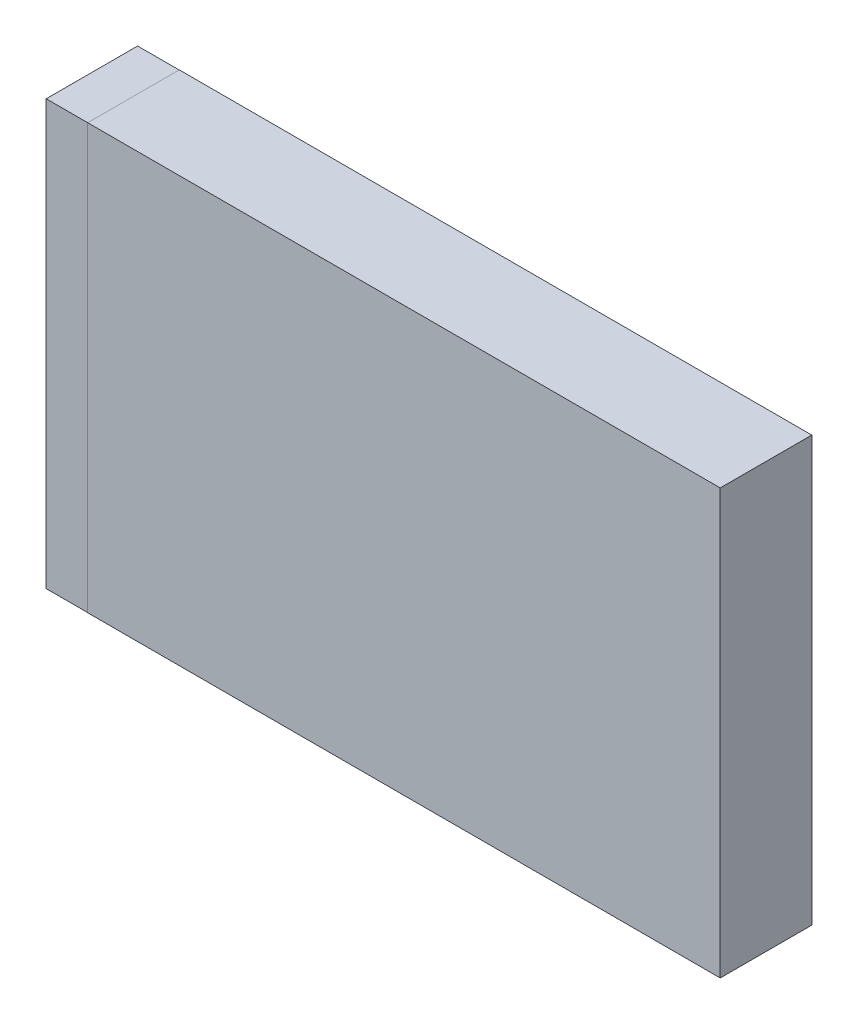
from build123d import *

# Parameters (mm, degrees)
SKETCH1_W           = 81
SKETCH1_H           = 51
BOSS_EXTRUDE1_DEPTH = 11
SKETCH2_W           = 5
SKETCH2_H           = 51
CUT_EXTRUDE1_DEPTH  = 0.01
SKETCH3_W           = 5
SKETCH3_H           = 10.99
CUT_EXTRUDE2_DEPTH  = 0.01
SKETCH4_W           = 5
SKETCH4_H           = 51
CUT_EXTRUDE3_DEPTH  = 0.01
SKETCH5_W           = 5
SKETCH5_H           = 11
CUT_EXTRUDE4_DEPTH  = 0.01


with BuildPart() as part:
    # Sketch1 → Boss-Extrude1 (new body)
    with BuildSketch(Plane.XY):
        with Locations((40.5, 25.5)):
            Rectangle(SKETCH1_W, SKETCH1_H)
    extrude(amount=BOSS_EXTRUDE1_DEPTH)

    # Sketch2 → Cut-Extrude1 (cut)
    with BuildSketch(Plane.XY.offset(11)):
        with Locations((2.5, 25.5)):
            Rectangle(SKETCH2_W, SKETCH2_H)
    extrude(amount=-CUT_EXTRUDE1_DEPTH, mode=Mode.SUBTRACT)

    # Sketch3 → Cut-Extrude2 (cut)
    with BuildSketch(Plane.XZ):
        with Locations((2.5, 5.495)):
            Rectangle(SKETCH3_W, SKETCH3_H)
    extrude(amount=-CUT_EXTRUDE2_DEPTH, mode=Mode.SUBTRACT)

    # Sketch4 → Cut-Extrude3 (cut)
    with BuildSketch(Plane(origin=(0, 0, 0), x_dir=(-1, 0, 0), z_dir=(0, 0, -1))):
        with Locations((-2.5, 25.5)):
            Rectangle(SKETCH4_W, SKETCH4_H)
    extrude(amount=-CUT_EXTRUDE3_DEPTH, mode=Mode.SUBTRACT)

    # Sketch5 → Cut-Extrude4 (cut)
    with BuildSketch(Plane(origin=(0, 51, 0), x_dir=(1, 0, 0), z_dir=(0, 1, 0))):
        with Locations((2.5, -5.5)):
            Rectangle(SKETCH5_W, SKETCH5_H)
    extrude(amount=-CUT_EXTRUDE4_DEPTH, mode=Mode.SUBTRACT)


solid = part.part
